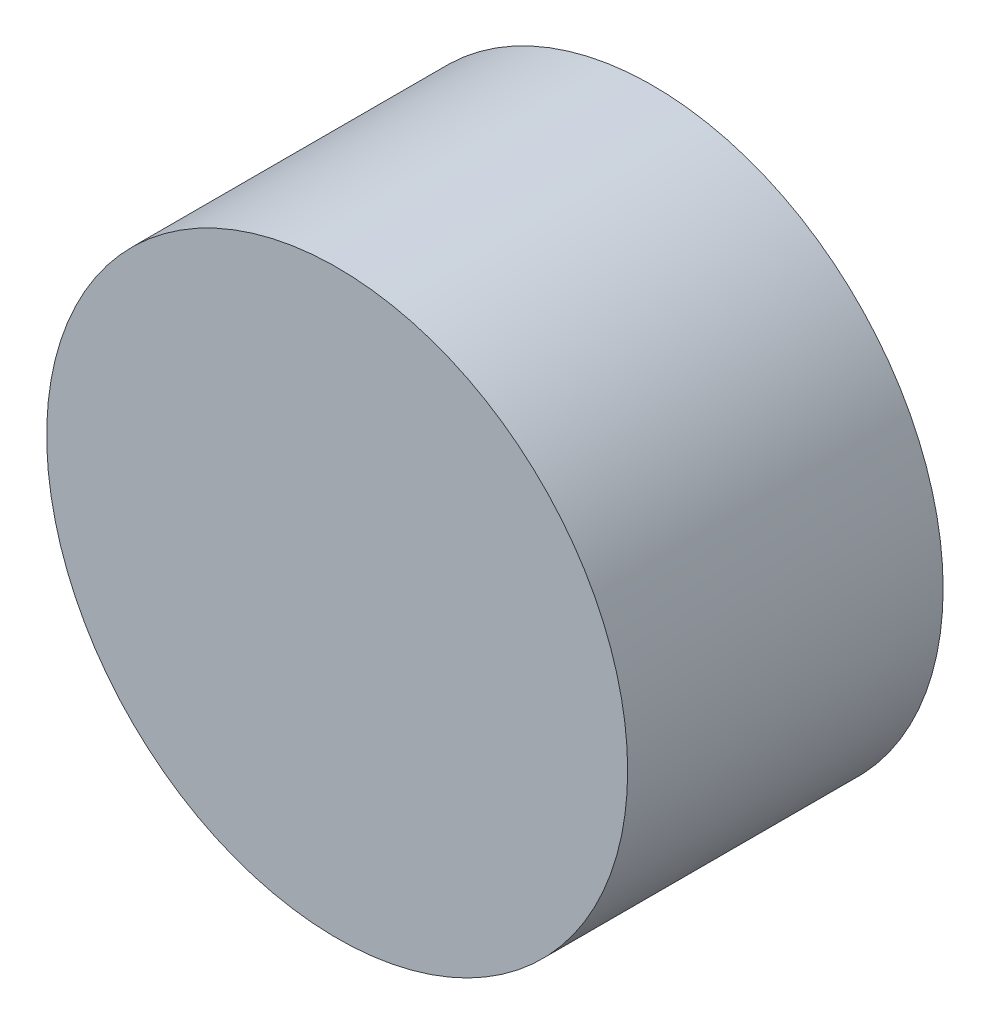
from build123d import *

# Parameters (mm, degrees)
SKETCH1_R           = 50.8
BOSS_EXTRUDE1_DEPTH = 55.1688


with BuildPart() as part:
    # Sketch1 → Boss-Extrude1 (new body)
    with BuildSketch(Plane.XY):
        Circle(SKETCH1_R)
    extrude(amount=BOSS_EXTRUDE1_DEPTH)


solid = part.part
